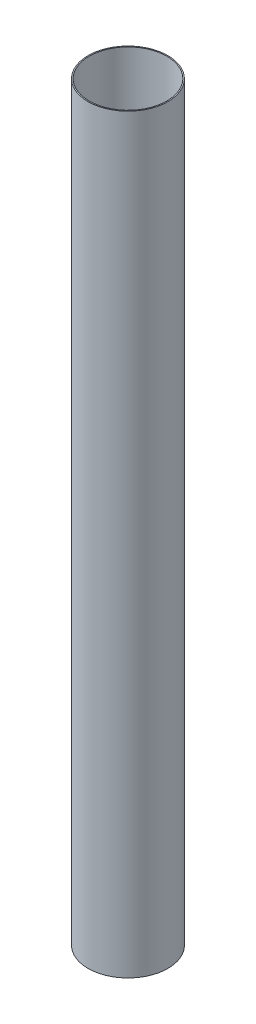
from build123d import *

# Parameters (mm, degrees)
BODY_TUBE_PROFILE_2_R   = 78.359
BODY_TUBE_PROFILE_2_R_2 = 76.2
BOSS_EXTRUDE1_DEPTH     = 1473.2


with BuildPart() as part:
    # Body Tube Profile<2> → Boss-Extrude1 (new body)
    with BuildSketch(Plane(origin=(0, 0, 0), x_dir=(1, 0, 0), z_dir=(0, 1, 0))):
        Circle(BODY_TUBE_PROFILE_2_R)
        Circle(BODY_TUBE_PROFILE_2_R_2, mode=Mode.SUBTRACT)
    extrude(amount=BOSS_EXTRUDE1_DEPTH)


solid = part.part
